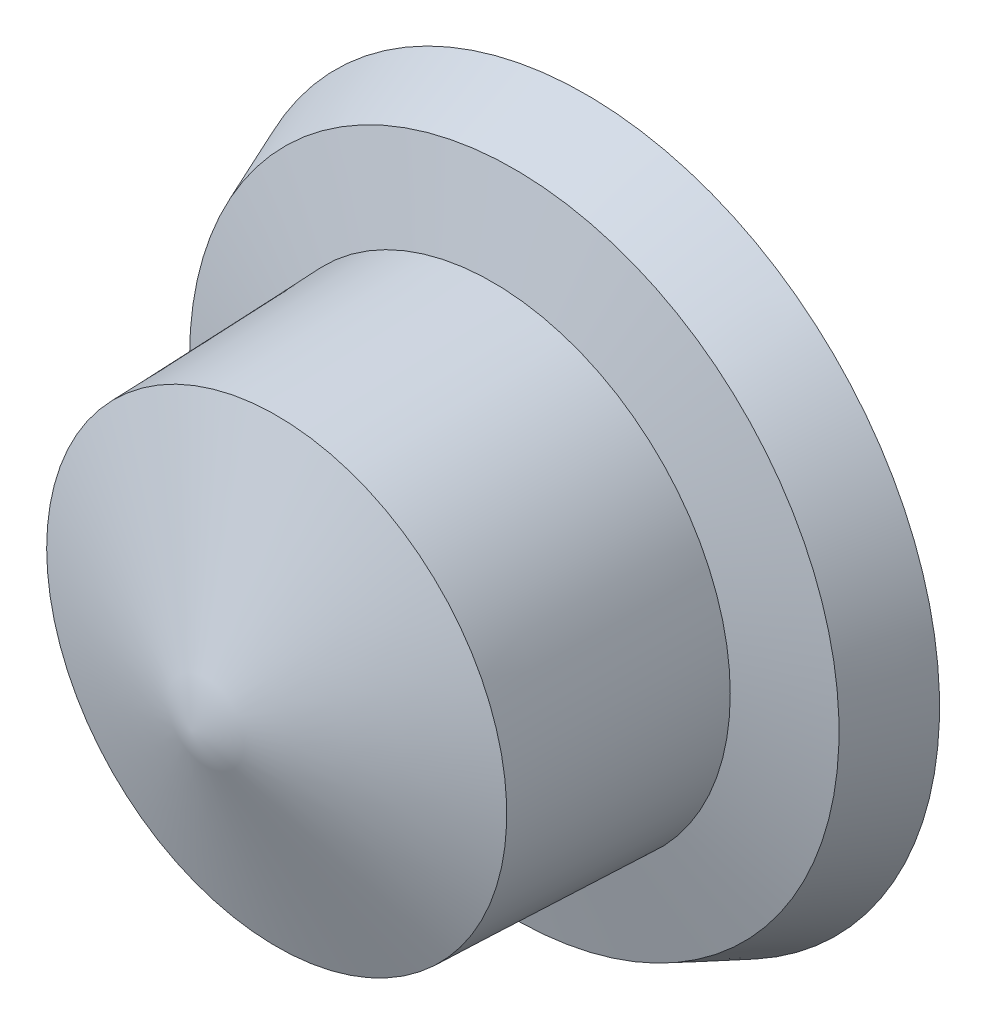
from build123d import *


with BuildPart() as part:
    # Sketch1 → Revolve1 (revolve)
    with BuildSketch(Plane(origin=(0, 0, 0), x_dir=(0, 0, -1), z_dir=(1, 0, 0)), mode=Mode.PRIVATE) as revolve1_sk:
        Polygon((0, 0), (3.333242, 9.002014), (11.778234, 9.301988), (12.629896, 12.707112), (15.428214, 13.84173), (15.428214, 0), align=None)
    revolve(revolve1_sk.sketch.rotate(Axis((0, 0, -15.428214), (0, 0, 1)), 90), axis=Axis((0, 0, -15.428214), (0, 0, 1)))


solid = part.part
